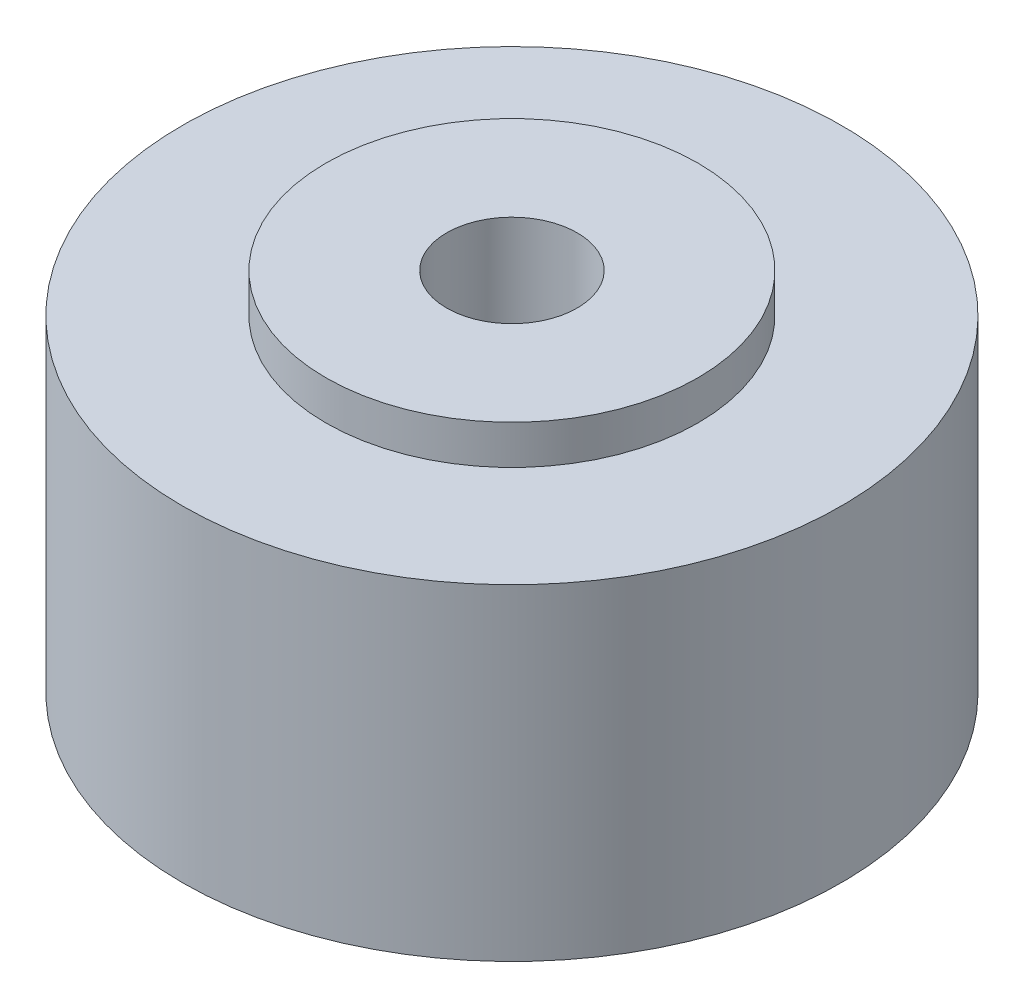
from build123d import *


with BuildPart() as part:
    # Sketch1 → Revolve1 (revolve)
    with BuildSketch(Plane.XY, mode=Mode.PRIVATE) as revolve1_sk:
        with BuildLine():
            Line((-23.185394109, 10), (-25.25, 10))
            Line((-25.25, 10), (-25.25, 35))
            Line((-25.25, 35), (-14.25, 35))
            Line((-14.25, 35), (-14.25, 38))
            Line((-14.25, 38), (-5, 38))
            Line((-5, 38), (-5, 24.75))
            ThreePointArc((-5, 24.75), (-15.905808224, 19.610399403), (-23.185394109, 10))
        make_face()
    revolve(revolve1_sk.sketch.rotate(Axis((0, 108.106230536, 0), (0, -1, 0)), 270), axis=Axis((0, 108.106230536, 0), (0, -1, 0)))


solid = part.part
